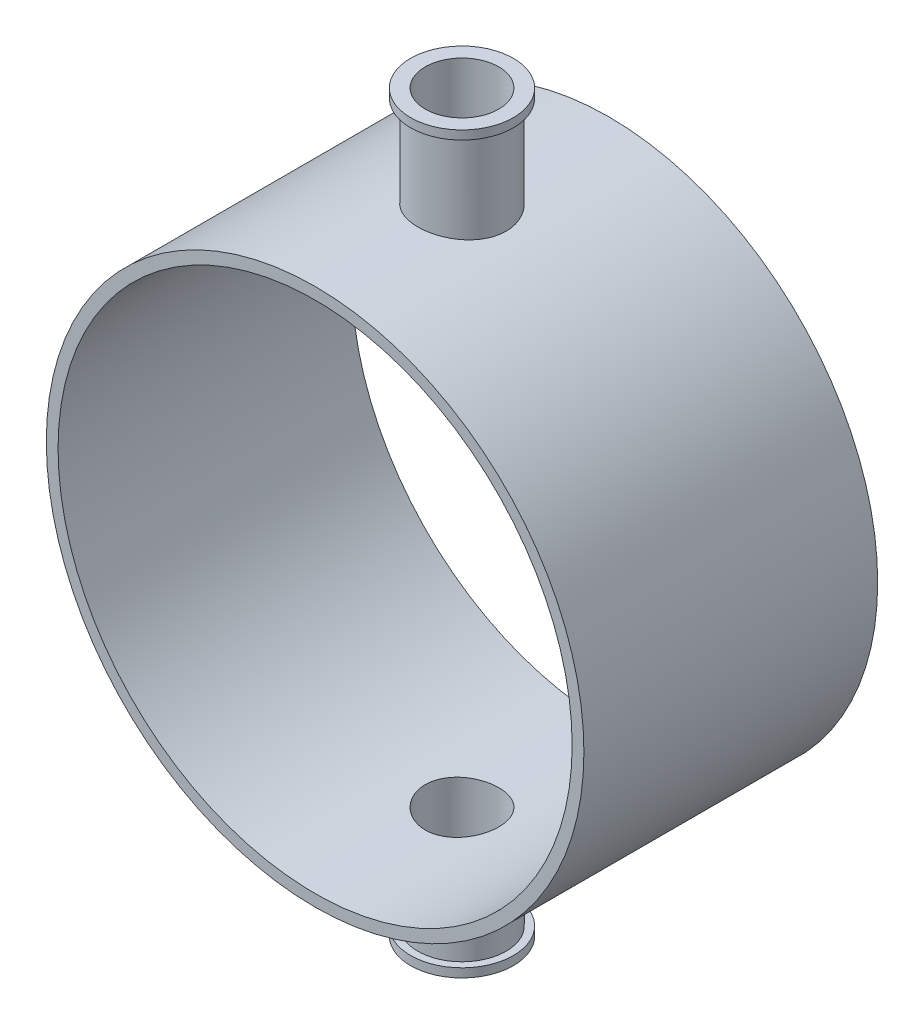
from build123d import *
from build123d.topology import SkipClean

# Parameters (mm, degrees)
SKETCH1_R           = 464.82
SKETCH1_R_2         = 444.5
BOSS_EXTRUDE1_DEPTH = 508
SKETCH2_R           = 76.2
SKETCH2_R_2         = 63.5
BOSS_EXTRUDE2_DEPTH = 635
SKETCH3_R           = 444.5
CUT_EXTRUDE1_DEPTH  = 698.5
SKETCH4_R           = 63.5
CUT_EXTRUDE2_DEPTH  = 1810.258
BOSS_EXTRUDE3_START = -15.24
SKETCH5_R           = 88.9
SKETCH5_R_2         = 76.2
BOSS_EXTRUDE3_DEPTH = 15.24


with BuildPart() as part:
    # Sketch1 → Boss-Extrude1 (new body)
    with BuildSketch(Plane.XY):
        Circle(SKETCH1_R)
        Circle(SKETCH1_R_2, mode=Mode.SUBTRACT)
    extrude(amount=-BOSS_EXTRUDE1_DEPTH)

    # Sketch2 → Boss-Extrude2 (add, symmetric)
    with BuildSketch(Plane(origin=(0, 0, 0), x_dir=(1, 0, 0), z_dir=(0, 1, 0))):
        with Locations(Location((0, 254, 0), (0, 0, 90))):
            Circle(SKETCH2_R)
        with Locations(Location((0, 254, 0), (0, 0, 90))):
            Circle(SKETCH2_R_2, mode=Mode.SUBTRACT)
    extrude(amount=BOSS_EXTRUDE2_DEPTH, both=True)

    # Sketch3 → Cut-Extrude1 (cut, symmetric)
    with BuildSketch(Plane(origin=(0, 0, -508), x_dir=(-1, 0, 0), z_dir=(0, 0, -1))):
        with Locations(Location((0, 0, 0), (0, 0, 180))):
            Circle(SKETCH3_R)
    extrude(amount=CUT_EXTRUDE1_DEPTH, both=True, mode=Mode.SUBTRACT)

    # Sketch4 → Cut-Extrude2 (cut, symmetric)
    with SkipClean():  # the faces are left unmerged after this step: merging them gives an invalid solid
        with BuildSketch(Plane(origin=(0, 635, 0), x_dir=(1, 0, 0), z_dir=(0, 1, 0))):
            with Locations(Location((0, 254, 0), (0, 0, 270))):
                Circle(SKETCH4_R)
        extrude(amount=CUT_EXTRUDE2_DEPTH, both=True, mode=Mode.SUBTRACT)

    # Sketch5 → Boss-Extrude3 (add)
    with SkipClean():  # the faces are left unmerged after this step: merging them gives an invalid solid
        with BuildSketch(Plane.XZ.offset(635).offset(BOSS_EXTRUDE3_START)):
            with Locations(Location((0, -254, 0), (0, 0, 270))):
                Circle(SKETCH5_R)
            with Locations(Location((0, -254, 0), (0, 0, 270))):
                Circle(SKETCH5_R_2, mode=Mode.SUBTRACT)
        boss_extrude3 = extrude(amount=BOSS_EXTRUDE3_DEPTH)

    # Mirror1: Boss-Extrude3 across plane
    add(boss_extrude3.mirror(Plane.ZX))


solid = part.part
